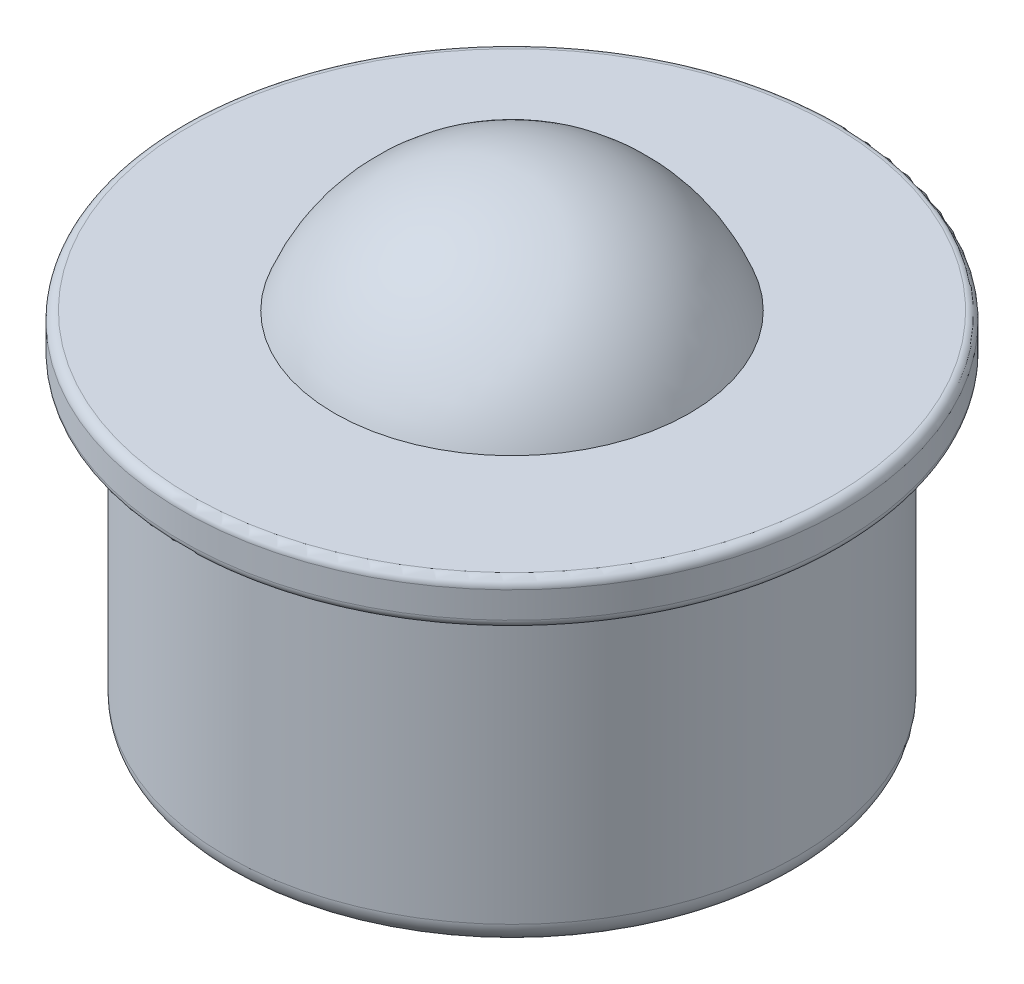
from build123d import *

# Parameters (mm, degrees)
FILLET_1_R = 0.5
FILLET_2_R = 0.2


with BuildPart() as part:
    # 草图1 → 旋转4 (revolve)
    with BuildSketch(Plane.XY, mode=Mode.PRIVATE) as revolve_4_sk:
        with BuildLine():
            Line((4.043760626, 8), (7.5, 8))
            Line((7.5, 8), (7.5, 7))
            Line((7.5, 7), (6.5, 7))
            Line((6.5, 7), (6.5, 0))
            Line((6.5, 0), (0, 0))
            Line((0, 0), (0, 10.8))
            ThreePointArc((0, 10.8), (2.459268184, 10.031675661), (4.043760626, 8))
        make_face()
    revolve(revolve_4_sk.sketch.rotate(Axis((0, 28.404003486, 0), (0, -1, 0)), 180), axis=Axis((0, 28.404003486, 0), (0, -1, 0)))

    # 圆角1
    fillet_1_edges = [part.edges().sort_by_distance(p)[0] for p in [
        (6.5, 0, 0),
    ]]
    fillet(fillet_1_edges, radius=FILLET_1_R)

    # 圆角2
    fillet_2_edges = [part.edges().sort_by_distance(p)[0] for p in [
        (7.5, 8, 0),
        (7.5, 7, 0),
    ]]
    fillet(fillet_2_edges, radius=FILLET_2_R)


solid = part.part
